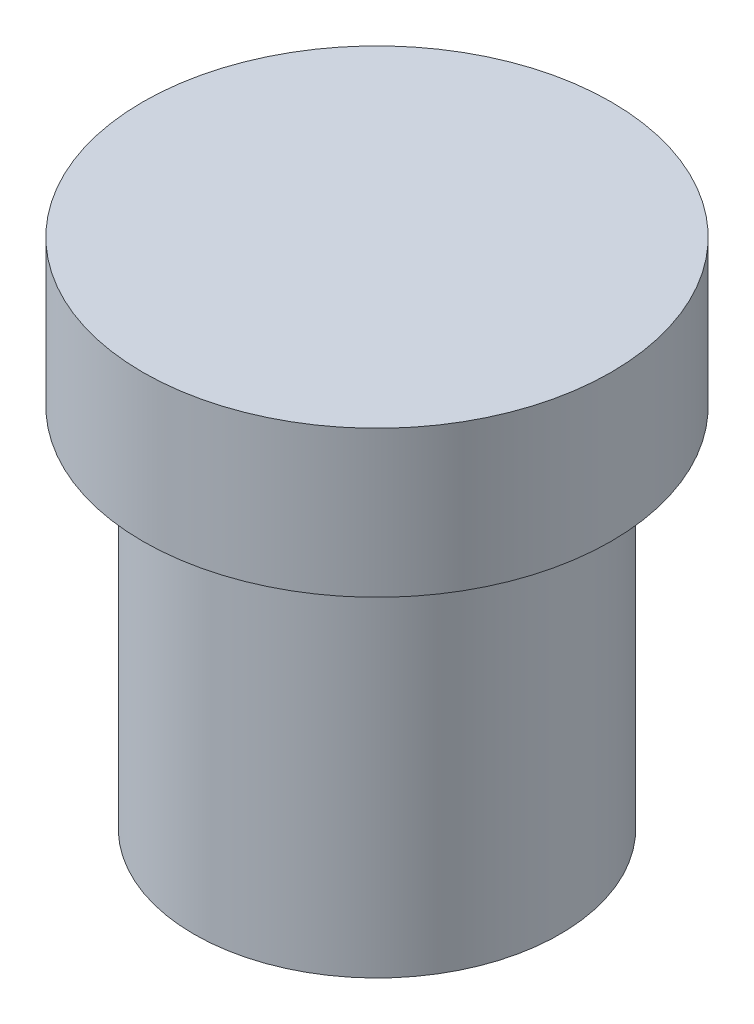
from build123d import *

# Parameters (mm, degrees)
SKETCH_1_R      = 2.5
EXTRUDE_1_DEPTH = 5
SKETCH_2_R      = 3.2
EXTRUDE_2_DEPTH = 2


with BuildPart() as part:
    # Эскиз1 → Бобышка-Вытянуть1 (new body)
    with BuildSketch(Plane(origin=(0, 0, 0), x_dir=(1, 0, 0), z_dir=(0, 1, 0))):
        with Locations(Location((0, 0, 0), (0, 0, 270))):
            Circle(SKETCH_1_R)
    extrude(amount=EXTRUDE_1_DEPTH)

    # Эскиз2 → Бобышка-Вытянуть2 (add)
    with BuildSketch(Plane(origin=(0, 5, 0), x_dir=(1, 0, 0), z_dir=(0, 1, 0))):
        with Locations(Location((0, 0, 0), (0, 0, 270))):
            Circle(SKETCH_2_R)
    extrude(amount=EXTRUDE_2_DEPTH)


solid = part.part
